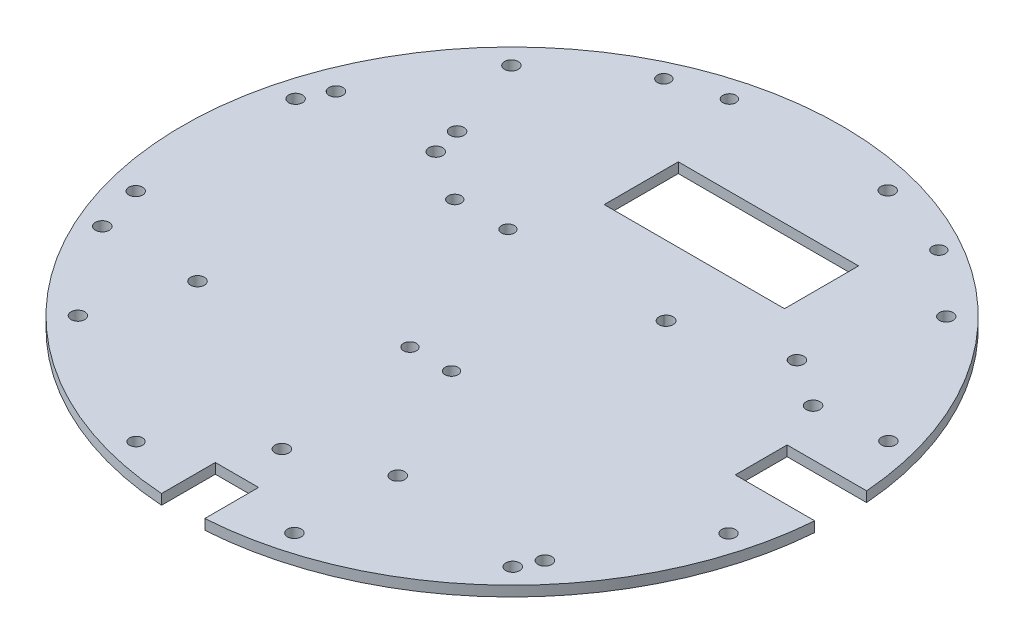
from build123d import *

# Parameters (mm, degrees)
BOSS_EXTRUDE1_DEPTH      = 1
BOSS_EXTRUDE1_DEPTH_BACK = 1.3622
SKETCH1_R                = 76.2
SKETCH1_R_2              = 1.6
SKETCH10_R               = 1.5
CUT_EXTRUDE4_DEPTH       = 108.788960422
SKETCH12_R               = 1.6
CUT_EXTRUDE6_DEPTH       = 108.788960422
SKETCH13_R               = 1.6
CUT_EXTRUDE7_DEPTH       = 10
SKETCH11_R               = 1.5
CUT_EXTRUDE5_DEPTH       = 10
SKETCH14_R               = 1.5875
SKETCH14_R_2             = 1.498962038
SKETCH14_W               = 10
SKETCH14_H               = 14
SKETCH14_W_2             = 41.679169521
SKETCH14_H_2             = 17.127679406
SKETCH14_W_3             = 21.415992251
SKETCH14_H_3             = 12
CUT_EXTRUDE8_DEPTH       = 10


with BuildPart() as part:
    # Sketch1 → Boss-Extrude1 (new, two sides: drawn at the far end of the back side and taken through both)
    with BuildSketch(Plane(origin=(0, 0, 0), x_dir=(1, 0, 0), z_dir=(0, 1, 0)).offset(-BOSS_EXTRUDE1_DEPTH_BACK)):
        with Locations(Location((0, 0, 0), (0, 0, 270))):
            Circle(SKETCH1_R)
        with Locations(Location((-41.747414599, 24.102881057, 0), (0, 0, 270))):
            Circle(SKETCH1_R_2, mode=Mode.SUBTRACT)
        with Locations(Location((41.747414599, 24.102881057, 0), (0, 0, 270))):
            Circle(SKETCH1_R_2, mode=Mode.SUBTRACT)
        with Locations(Location((0, -53.205762114, 0), (0, 0, 90))):
            Circle(SKETCH1_R_2, mode=Mode.SUBTRACT)
    extrude(amount=BOSS_EXTRUDE1_DEPTH + BOSS_EXTRUDE1_DEPTH_BACK)

    # Sketch10 → Cut-Extrude4 (cut, through all)
    with BuildSketch(Plane(origin=(0, 1, 0), x_dir=(1, 0, 0), z_dir=(0, 1, 0))):
        with Locations(Location((-5.6, -18, 0), (0, 0, 270))):
            Circle(SKETCH10_R)
        with Locations(Location((4, -18, 0), (0, 0, 90))):
            Circle(SKETCH10_R)
    extrude(amount=-CUT_EXTRUDE4_DEPTH, mode=Mode.SUBTRACT)

    # Sketch12 → Cut-Extrude6 (cut, through all)
    with BuildSketch(Plane(origin=(0, 1, 0), x_dir=(1, 0, 0), z_dir=(0, 1, 0))):
        with Locations(Location((-65.339987017, 24.618692946, 0), (0, 0, 270))):
            Circle(SKETCH12_R)
        with Locations(Location((-43.339987017, 30.618692946, 0), (0, 0, 270))):
            Circle(SKETCH12_R)
        with Locations(Location((-65.339987017, -29.381307054, 0), (0, 0, 270))):
            Circle(SKETCH12_R)
        with Locations(Location((-43.339987017, -29.381307054, 0), (0, 0, 270))):
            Circle(SKETCH12_R)
    extrude(amount=-CUT_EXTRUDE6_DEPTH, mode=Mode.SUBTRACT)

    # Sketch13 → Cut-Extrude7 (cut)
    with BuildSketch(Plane(origin=(0, 1, 0), x_dir=(1, 0, 0), z_dir=(0, 1, 0))):
        with Locations(Location((18.720998736, -45.143629297, 0), (0, 0, 270))):
            Circle(SKETCH13_R)
        with Locations(Location((52.719216113, 16.857348236, 0), (0, 0, 270))):
            Circle(SKETCH13_R)
        with Locations(Location((52.720998722, -45.142651738, 0), (0, 0, 270))):
            Circle(SKETCH13_R)
        with Locations(Location((18.719216128, 16.856370677, 0), (0, 0, 270))):
            Circle(SKETCH13_R)
    extrude(amount=-CUT_EXTRUDE7_DEPTH, mode=Mode.SUBTRACT)

    # Sketch11 → Cut-Extrude5 (cut)
    with BuildSketch(Plane(origin=(0, 1, 0), x_dir=(1, 0, 0), z_dir=(0, 1, 0))):
        with Locations(Location((36.103302507, 62.553143535, 0), (0, 0, 270))):
            Circle(SKETCH11_R)
        with Locations(Location((-29.973606883, 65.04314353, 0), (0, 0, 270))):
            Circle(SKETCH11_R)
        with Locations(Location((-29.973606883, 16.72314354, 0), (0, 0, 270))):
            Circle(SKETCH11_R)
    extrude(amount=-CUT_EXTRUDE5_DEPTH, mode=Mode.SUBTRACT)

    # Sketch14 → Cut-Extrude8 (cut)
    with BuildSketch(Plane(origin=(0, 1, 0), x_dir=(1, 0, 0), z_dir=(0, 1, 0))):
        with Locations(Location((-50.263897192, 50.100376278, 0), (0, 0, 270))):
            Circle(SKETCH14_R)
        with Locations(Location((-68.520147192, 18.479623722, 0), (0, 0, 270))):
            Circle(SKETCH14_R)
        with Locations(Location((18.25625, -68.58, 0), (0, 0, 270))):
            Circle(SKETCH14_R)
        with Locations(Location((-18.344787962, -68.58, 0), (0, 0, 270))):
            Circle(SKETCH14_R_2)
        with Locations(Location((50.263897192, 50.100376278, 0), (0, 0, 270))):
            Circle(SKETCH14_R)
        with Locations(Location((68.520147192, 18.479623722, 0), (0, 0, 270))):
            Circle(SKETCH14_R)
        with Locations(Location((-17.86667883, 16.903556997, 0), (0, 0, 270))):
            Circle(SKETCH14_R_2)
        with Locations((18.734359132, 16.903556997)):
            Circle(SKETCH14_R)
        with Locations(Location((-18.344787962, 68.58, 0), (0, 0, 270))):
            Circle(SKETCH14_R_2)
        with Locations(Location((18.25625, 68.58, 0), (0, 0, 270))):
            Circle(SKETCH14_R)
        with Locations(Location((-50.263897192, -50.100376278, 0), (0, 0, 270))):
            Circle(SKETCH14_R)
        with Locations(Location((-68.520147192, -18.479623722, 0), (0, 0, 270))):
            Circle(SKETCH14_R)
        with Locations(Location((50.263897192, -50.100376278, 0), (0, 0, 270))):
            Circle(SKETCH14_R)
        with Locations(Location((68.520147192, -18.479623722, 0), (0, 0, 270))):
            Circle(SKETCH14_R)
        with Locations((0, -70.602742007)):
            Rectangle(SKETCH14_W, SKETCH14_H)
        with Locations((9.16041524, 41.536536575)):
            Rectangle(SKETCH14_W_2, SKETCH14_H_2)
        with Locations((68.289586454, 0)):
            Rectangle(SKETCH14_W_3, SKETCH14_H_3)
    extrude(amount=-CUT_EXTRUDE8_DEPTH, mode=Mode.SUBTRACT)


solid = part.part
